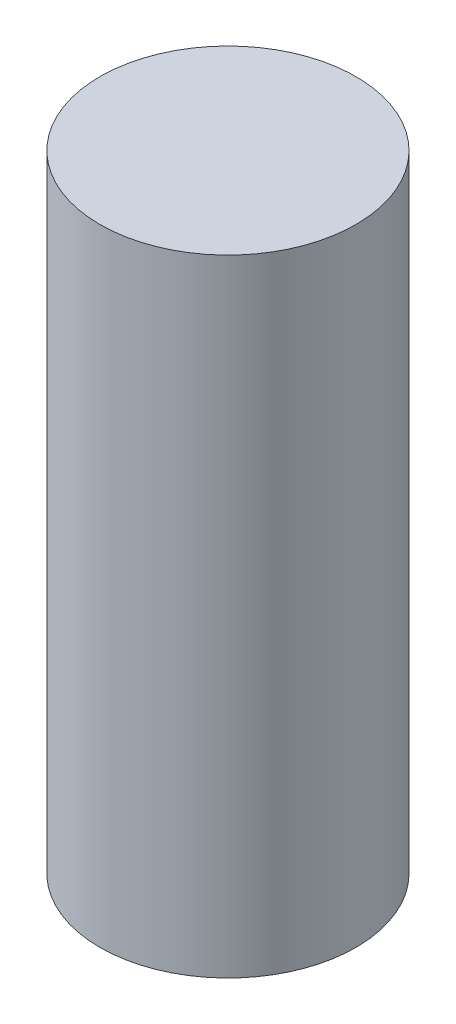
from build123d import *

# Parameters (mm, degrees)
SKETCH1_R           = 13.5
SKETCH1_R_2         = 12.75
BOSS_EXTRUDE1_DEPTH = 64
SKETCH2_R           = 13.5
BOSS_EXTRUDE2_DEPTH = 2


with BuildPart() as part:
    # Sketch1 → Boss-Extrude1 (new body)
    with BuildSketch(Plane(origin=(0, 0, 0), x_dir=(1, 0, 0), z_dir=(0, 1, 0))):
        with Locations(Location((0, 0, 0), (0, 0, 270))):
            Circle(SKETCH1_R)
        with Locations(Location((0, 0, 0), (0, 0, 270))):
            Circle(SKETCH1_R_2, mode=Mode.SUBTRACT)
    extrude(amount=BOSS_EXTRUDE1_DEPTH)

    # Sketch2 → Boss-Extrude2 (add)
    with BuildSketch(Plane(origin=(0, 64, 0), x_dir=(1, 0, 0), z_dir=(0, 1, 0))):
        with Locations(Location((0, 0, 0), (0, 0, 270))):
            Circle(SKETCH2_R)
    extrude(amount=BOSS_EXTRUDE2_DEPTH)


solid = part.part
